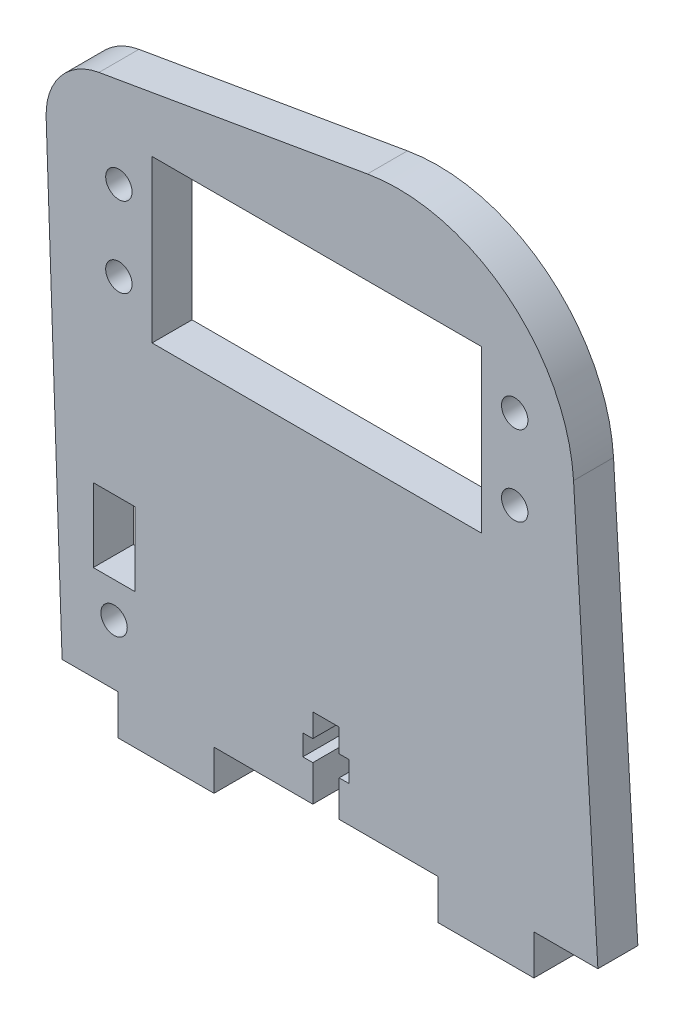
from build123d import *

# Parameters (mm, degrees)
ESKIZ_KONTUR_W        = 5.2
ESKIZ_KONTUR_H        = 9.2
ESKIZ_KONTUR_W_2      = 41.2
ESKIZ_KONTUR_H_2      = 20.2
PLASTINA_DEPTH        = 5
OTVERSTIYA_DEPTH      = 85.528105852
OTVERSTIYA_DEPTH_BACK = 85.528105852
ESKIZ_OTVERSTIYA_R    = 1.65


with BuildPart() as part:
    # Eskiz_kontur → Plastina (new body)
    with BuildSketch(Plane.XY):
        with BuildLine():
            Line((21.958964111, 51.343070401), (24.999994111, 4.01e-07))
            Line((24.999994111, 4.01e-07), (17, 4.01e-07))
            Line((17, 4.01e-07), (17, -5))
            Line((17, -5), (5, -5))
            Line((5, -5), (5, 0))
            Line((5, 0), (-7.35, 0))
            Line((-7.35, 0), (-7.35, 4.5))
            Line((-7.35, 4.5), (-6.1, 4.5))
            Line((-6.1, 4.5), (-6.1, 7.1))
            Line((-6.1, 7.1), (-7.35, 7.1))
            Line((-7.35, 7.1), (-7.35, 10))
            Line((-7.35, 10), (-10.65, 10))
            Line((-10.65, 10), (-10.65, 7.1))
            Line((-10.65, 7.1), (-11.9, 7.1))
            Line((-11.9, 7.1), (-11.9, 4.5))
            Line((-11.9, 4.5), (-10.65, 4.5))
            Line((-10.65, 4.5), (-10.65, 0))
            Line((-10.65, 0), (-23, 0))
            Line((-23, 0), (-23, -5))
            Line((-23, -5), (-35, -5))
            Line((-35, -5), (-35, 0))
            Line((-35, 0), (-42, 0))
            Line((-42, 0), (-43.99513, 57.7208))
            ThreePointArc((-43.99513, 57.7208), (-42.217170806, 63.034563621), (-37.389183787, 65.878463067))
            Line((-37.389183787, 65.878463067), (-3.820263787, 71.665773067))
            ThreePointArc((-3.820263787, 71.665773067), (13.620063981, 67.276975245), (21.958964111, 51.343070401))
        make_face()
        with Locations((-35.5, 16.5)):
            Rectangle(ESKIZ_KONTUR_W, ESKIZ_KONTUR_H, mode=Mode.SUBTRACT)
        with Locations((-10.15, 50)):
            Rectangle(ESKIZ_KONTUR_W_2, ESKIZ_KONTUR_H_2, mode=Mode.SUBTRACT)
    extrude(amount=PLASTINA_DEPTH)

    # Eskiz_otverstiya → Otverstiya (cut, two sides: drawn at the far end of the back side and taken through both)
    with BuildSketch(Plane.XY.offset(-OTVERSTIYA_DEPTH_BACK)):
        with Locations((-35.5, 7.5)):
            Circle(ESKIZ_OTVERSTIYA_R)
        with Locations((-34.9, 45)):
            Circle(ESKIZ_OTVERSTIYA_R)
        with Locations((-34.9, 55)):
            Circle(ESKIZ_OTVERSTIYA_R)
        with Locations((14.6, 45)):
            Circle(ESKIZ_OTVERSTIYA_R)
        with Locations((14.6, 55)):
            Circle(ESKIZ_OTVERSTIYA_R)
    extrude(amount=OTVERSTIYA_DEPTH + OTVERSTIYA_DEPTH_BACK, mode=Mode.SUBTRACT)


solid = part.part
